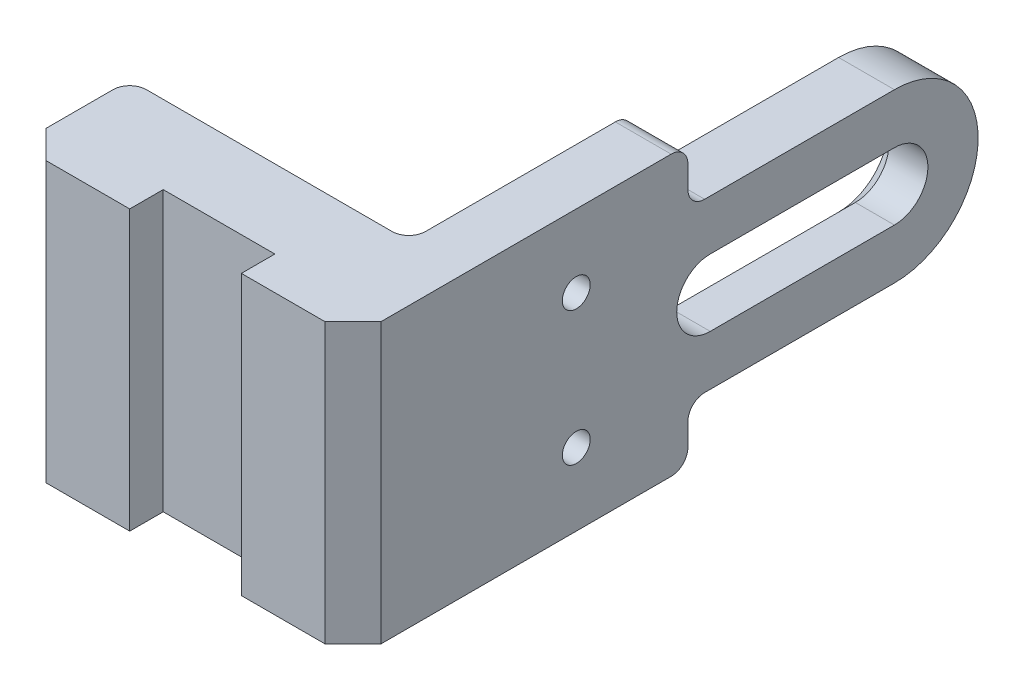
from build123d import *

# Parameters (mm, degrees)
BOSS_EXTRUDE1_DEPTH = 25
CUT_EXTRUDE1_DEPTH  = 25
CUT_EXTRUDE2_DEPTH  = 25
FILLET1_R           = 1.5
SKETCH5_R           = 1.25
CUT_EXTRUDE4_DEPTH  = 25
CUT_EXTRUDE5_START  = -2.5
SKETCH5_4_R         = 3
SKETCH5_4_R_2       = 1.25
CUT_EXTRUDE5_DEPTH  = 2.5
SKETCH7_W           = 10
SKETCH7_H           = 3
CUT_EXTRUDE6_DEPTH  = 69.271516755
CHAMFER1_SIZE       = 2.5
FILLET2_R           = 1.5
CHAMFER2_SIZE       = 1.5


with BuildPart() as part:
    # Sketch1 → Boss-Extrude1 (new body)
    with BuildSketch(Plane(origin=(0, 0, 0), x_dir=(1, 0, 0), z_dir=(0, 1, 0))):
        Polygon((0, 0), (-30, 0), (-30, 10), (-5, 10), (-5, 56), (0, 56), align=None)
    extrude(amount=BOSS_EXTRUDE1_DEPTH)

    # Sketch2 → Cut-Extrude1 (cut)
    with BuildSketch(Plane(origin=(0, 0, 0), x_dir=(0, 0, -1), z_dir=(1, 0, 0))):
        with BuildLine():
            Line((56, 25), (30, 25))
            Line((30, 25), (30, 20))
            Line((30, 20), (48.5, 20))
            ThreePointArc((48.5, 20), (53.803300859, 17.803300859), (56, 12.5))
            Line((56, 12.5), (56, 25))
        make_face()
        with BuildLine():
            ThreePointArc((56, 12.5), (53.803300859, 7.196699141), (48.5, 5))
            Line((48.5, 5), (30, 5))
            Line((30, 5), (30, 0))
            Line((30, 0), (56, 0))
            Line((56, 0), (56, 12.5))
        make_face()
    extrude(amount=-CUT_EXTRUDE1_DEPTH, mode=Mode.SUBTRACT)

    # Sketch3 → Cut-Extrude2 (cut)
    with BuildSketch(Plane(origin=(0, 0, 0), x_dir=(0, 0, -1), z_dir=(1, 0, 0))):
        with BuildLine():
            Line((32, 15.5), (48.5, 15.5))
            ThreePointArc((48.5, 15.5), (51.5, 12.5), (48.5, 9.5))
            Line((48.5, 9.5), (32, 9.5))
            ThreePointArc((32, 9.5), (29, 12.5), (32, 15.5))
        make_face()
    extrude(amount=-CUT_EXTRUDE2_DEPTH, mode=Mode.SUBTRACT)

    # Fillet1
    fillet1_edges = [part.edges().sort_by_distance(p)[0] for p in [
        (-2.5, 20, -30),
        (-2.5, 5, -30),
        (-2.5, 0, -30),
        (-2.5, 25, -30),
    ]]
    fillet(fillet1_edges, radius=FILLET1_R)

    # Sketch5 → Cut-Extrude4 (cut)
    with BuildSketch(Plane(origin=(0, 0, 0), x_dir=(0, 0, -1), z_dir=(1, 0, 0))):
        with Locations((20, 18.5)):
            Circle(SKETCH5_R)
        with Locations((20, 6.5)):
            Circle(SKETCH5_R)
    extrude(amount=-CUT_EXTRUDE4_DEPTH, mode=Mode.SUBTRACT)

    # Sketch5<4> → Cut-Extrude5 (cut)
    # profile 1 of 2: a face of its own
    with BuildSketch(Plane(origin=(0, 0, 0), x_dir=(0, 0, -1), z_dir=(1, 0, 0)).offset(CUT_EXTRUDE5_START)):
        with Locations((20, 18.5)):
            Circle(SKETCH5_4_R)
        with Locations((20, 18.5)):
            Circle(SKETCH5_4_R_2, mode=Mode.SUBTRACT)
    # profile 2 of 2: a face of its own
    with BuildSketch(Plane(origin=(0, 0, 0), x_dir=(0, 0, -1), z_dir=(1, 0, 0)).offset(CUT_EXTRUDE5_START)):
        with Locations((20, 6.5)):
            Circle(SKETCH5_4_R)
        with Locations((20, 6.5)):
            Circle(SKETCH5_4_R_2, mode=Mode.SUBTRACT)
    extrude(amount=-CUT_EXTRUDE5_DEPTH, mode=Mode.SUBTRACT)

    # Sketch7 → Cut-Extrude6 (cut, through all)
    with BuildSketch(Plane(origin=(0, 25, 0), x_dir=(1, 0, 0), z_dir=(0, 1, 0))):
        with Locations((-15, 1.5)):
            Rectangle(SKETCH7_W, SKETCH7_H)
    extrude(amount=-CUT_EXTRUDE6_DEPTH, mode=Mode.SUBTRACT)

    # Chamfer1
    chamfer1_edges = [part.edges().sort_by_distance(p)[0] for p in [
        (0, 12.5, 0),
        (-30, 12.5, 0),
    ]]
    chamfer(chamfer1_edges, length=CHAMFER1_SIZE)

    # Fillet2
    fillet2_edges = [part.edges().sort_by_distance(p)[0] for p in [
        (-30, 12.5, -10),
        (-5, 12.5, -10),
    ]]
    fillet(fillet2_edges, radius=FILLET2_R)

    # Chamfer2
    chamfer2_edges = [part.edges().sort_by_distance(p)[0] for p in [
        (-5, 9.5, -40.25),
        (-5, 12.5, -51.5),
        (-5, 12.5, -29),
        (-5, 15.5, -40.25),
    ]]
    chamfer(chamfer2_edges, length=CHAMFER2_SIZE)


solid = part.part
